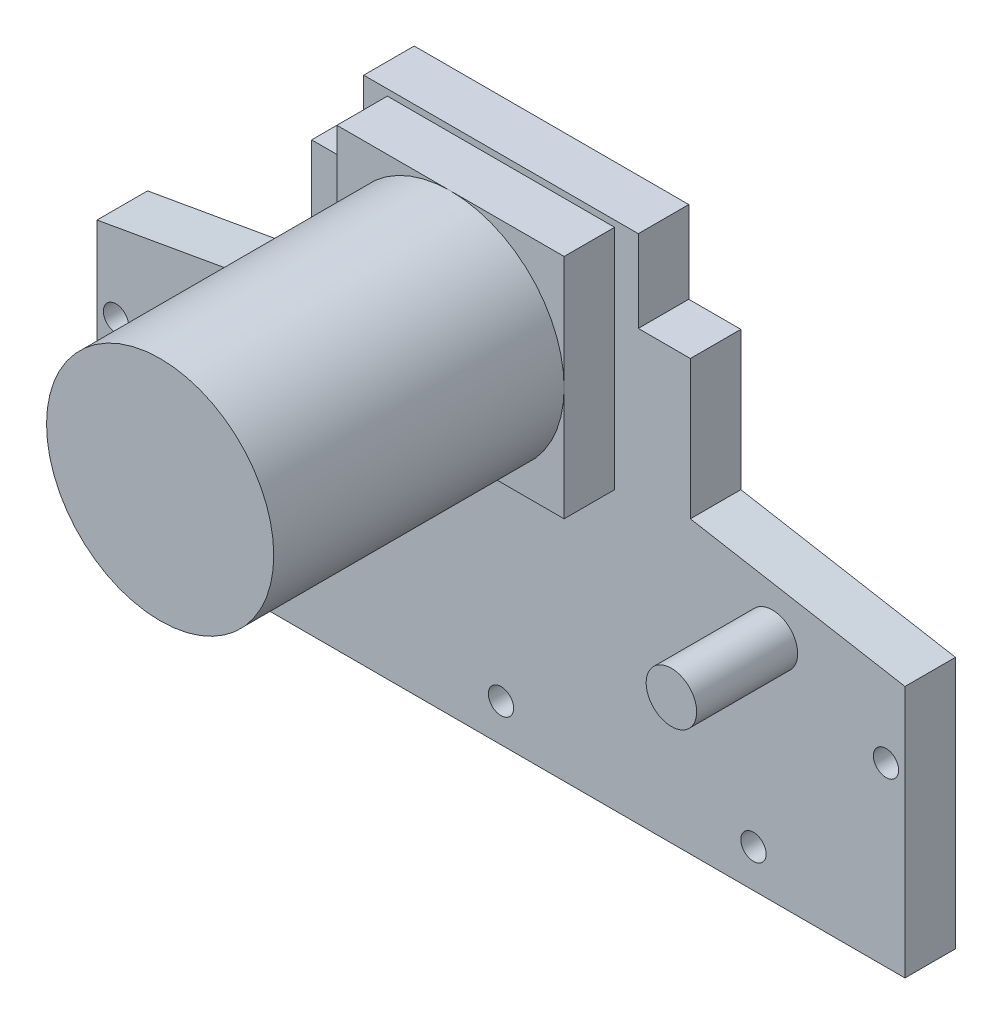
from build123d import *

# Parameters (mm, degrees)
SKETCH1_W           = 30
SKETCH1_H           = 11
SKETCH1_W_2         = 21.75
SKETCH1_H_2         = 6.5
BOSS_EXTRUDE1_DEPTH = 4
SKETCH2_R           = 1
CUT_EXTRUDE1_DEPTH  = 5
SKETCH3_R           = 9
BOSS_EXTRUDE2_DEPTH = 27
SKETCH5_W           = 18
SKETCH5_H           = 18
BOSS_EXTRUDE3_DEPTH = 3
SKETCH6_R           = 2
BOSS_EXTRUDE4_DEPTH = 8
SKETCH7_W           = 18
SKETCH7_H           = 18
BOSS_EXTRUDE5_DEPTH = 4


with BuildPart() as part:
    # Sketch1 → Boss-Extrude1 (new body)
    with BuildSketch(Plane.XY):
        Polygon((32, 0), (32, 20), (15, 23), (-15, 23), (-32, 20), (-32, 0), align=None)
        with Locations((0, 28.5)):
            Rectangle(SKETCH1_W, SKETCH1_H)
        with Locations((0, 37.25)):
            Rectangle(SKETCH1_W_2, SKETCH1_H_2)
    extrude(amount=BOSS_EXTRUDE1_DEPTH)

    # Sketch2 → Cut-Extrude1 (cut)
    with BuildSketch(Plane.XY.offset(4)):
        with Locations((20, 3)):
            Circle(SKETCH2_R)
        with Locations((0, 3)):
            Circle(SKETCH2_R)
        with Locations((-20, 3)):
            Circle(SKETCH2_R)
        with Locations((-30.5, 14)):
            Circle(SKETCH2_R)
        with Locations((30.5, 14)):
            Circle(SKETCH2_R)
    extrude(amount=-CUT_EXTRUDE1_DEPTH, mode=Mode.SUBTRACT)

    # Sketch3 → Boss-Extrude2 (add)
    with BuildSketch(Plane.XY.offset(4)):
        with Locations((0, 31)):
            Circle(SKETCH3_R)
    extrude(amount=BOSS_EXTRUDE2_DEPTH)

    # Sketch5 → Boss-Extrude3 (add)
    with BuildSketch(Plane(origin=(0, 0, 0), x_dir=(-1, 0, 0), z_dir=(0, 0, -1))):
        with Locations((4, 19)):
            Rectangle(SKETCH5_W, SKETCH5_H)
    extrude(amount=BOSS_EXTRUDE3_DEPTH)

    # Sketch6 → Boss-Extrude4 (add)
    with BuildSketch(Plane.XY.offset(4)):
        with Locations((21.5, 18)):
            Circle(SKETCH6_R)
        with Locations((-21.5, 18)):
            Circle(SKETCH6_R)
    extrude(amount=BOSS_EXTRUDE4_DEPTH)

    # Sketch7 → Boss-Extrude5 (add)
    with BuildSketch(Plane.XY.offset(4)):
        with Locations((0, 31)):
            Rectangle(SKETCH7_W, SKETCH7_H)
    extrude(amount=BOSS_EXTRUDE5_DEPTH)


solid = part.part
